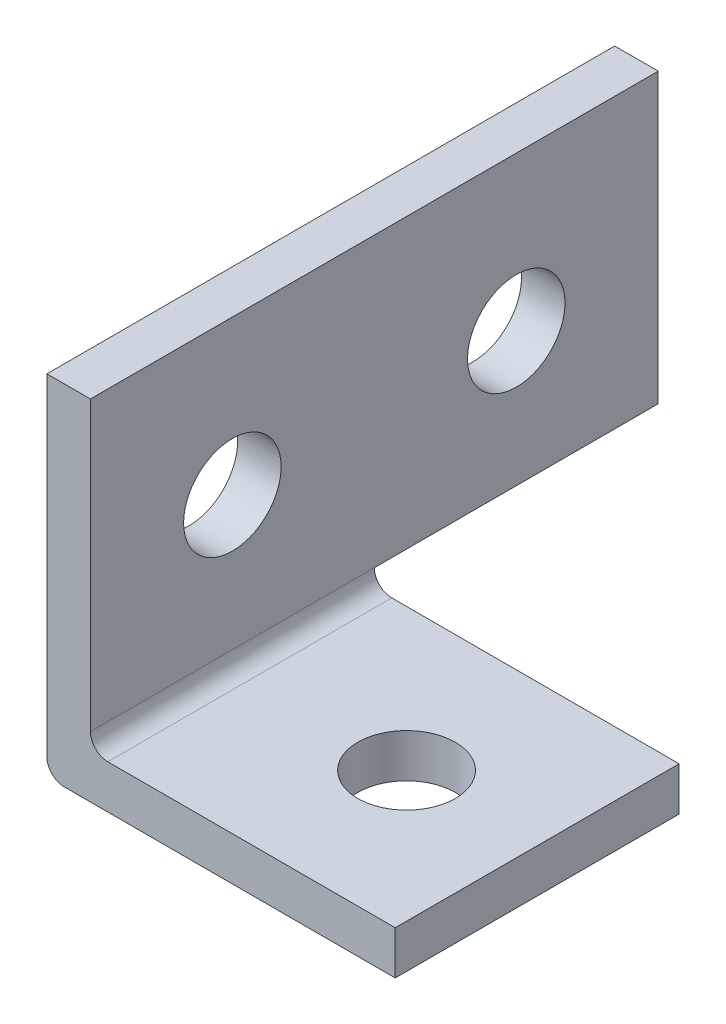
from build123d import *

# Parameters (mm, degrees)
EXTRUDE_1_DEPTH     = 41.402
SKETCH_4_R          = 7.112
CUT_EXTRUDE_1_DEPTH = 83.979969858
SKETCH_3_R          = 7.112
CUT_EXTRUDE_2_DEPTH = 83.979969858
SKETCH1_W           = 41.402
SKETCH1_H           = 42.010980282
BOSS_EXTRUDE1_DEPTH = 6.35
SKETCH2_R           = 7.112
CUT_EXTRUDE1_DEPTH  = 80.251737506


with BuildPart() as part:
    # 草图1 → 凸台-拉伸1 (new body)
    with BuildSketch(Plane.XY):
        with BuildLine():
            Line((2.54, 0), (50.8, 0))
            Line((50.8, 0), (50.8, 6.35))
            Line((50.8, 6.35), (8.89, 6.35))
            ThreePointArc((8.89, 6.35), (7.093948776, 7.093948776), (6.35, 8.89))
            Line((6.35, 8.89), (6.35, 50.900980282))
            Line((6.35, 50.900980282), (0, 50.900980282))
            Line((0, 50.900980282), (0, 2.54))
            ThreePointArc((0, 2.54), (0.743948776, 0.743948776), (2.54, 0))
        make_face()
    extrude(amount=EXTRUDE_1_DEPTH)

    # 草图4 → 切除-拉伸1 (cut, through all)
    with BuildSketch(Plane.ZY):
        with Locations((20.701, 28.448)):
            Circle(SKETCH_4_R)
    extrude(amount=-CUT_EXTRUDE_1_DEPTH, mode=Mode.SUBTRACT)

    # 草图3 → 切除-拉伸2 (cut, through all)
    with BuildSketch(Plane(origin=(0, 0, 0), x_dir=(-1, 0, 0), z_dir=(0, -1, 0))):
        with Locations(Location((-31.75, -20.701, 0), (0, 0, 90))):
            Circle(SKETCH_3_R)
    extrude(amount=-CUT_EXTRUDE_2_DEPTH, mode=Mode.SUBTRACT)

    # Sketch1 → Boss-Extrude1 (add)
    with BuildSketch(Plane(origin=(6.35, 0, 0), x_dir=(0, 0, -1), z_dir=(1, 0, 0))):
        with Locations((20.701, 29.895490141)):
            Rectangle(SKETCH1_W, SKETCH1_H)
    extrude(amount=-BOSS_EXTRUDE1_DEPTH)

    # Sketch2 → Cut-Extrude1 (cut, through all)
    with BuildSketch(Plane(origin=(6.35, 0, 0), x_dir=(0, 0, -1), z_dir=(1, 0, 0))):
        with Locations(Location((-20.701, 28.448, 0), (0, 0, 180))):
            Circle(SKETCH2_R)
        with Locations((20.701, 28.448)):
            Circle(SKETCH2_R)
    extrude(amount=-CUT_EXTRUDE1_DEPTH, mode=Mode.SUBTRACT)


solid = part.part
